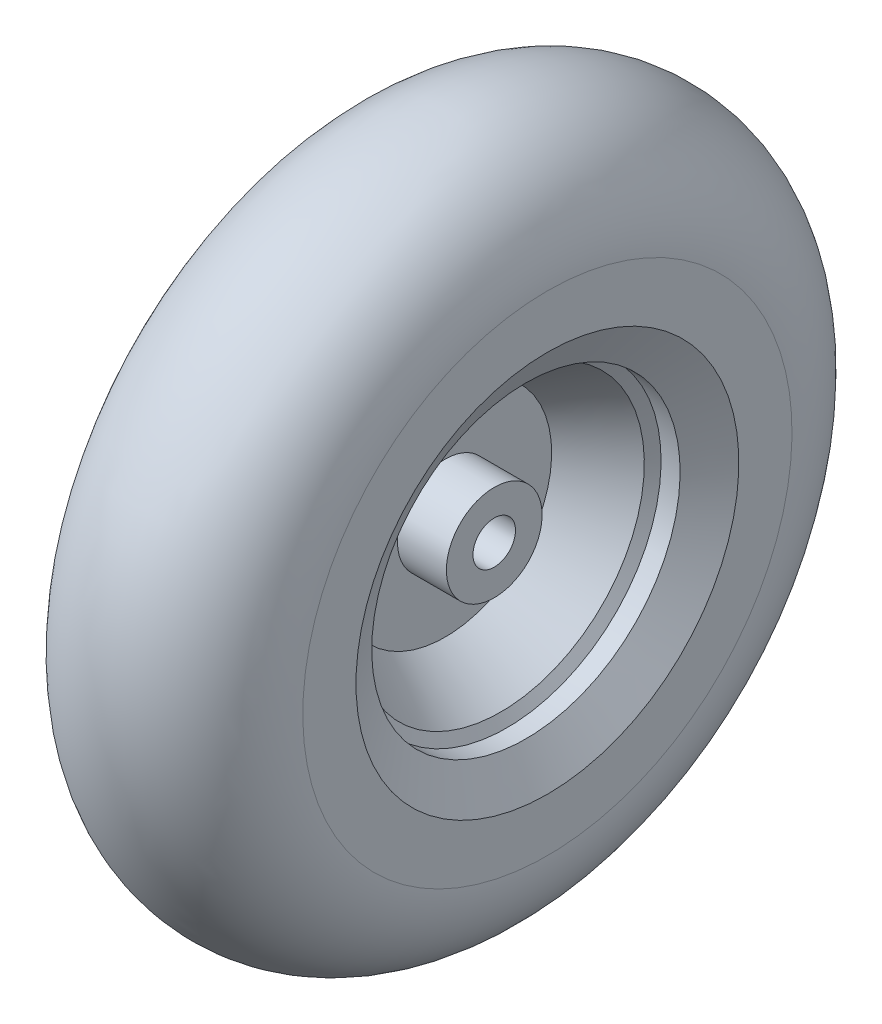
from build123d import *


with BuildPart() as part:
    # Sketch1 → Revolve1 (revolve)
    with BuildSketch(Plane.XY):
        with BuildLine():
            Line((50, 90), (50, 115))
            ThreePointArc((50, 115), (0, 165), (-50, 115))
            Line((-50, 115), (-50, 90))
            Line((-50, 90), (-39.896370289, 72.5))
            Line((-39.896370289, 72.5), (-30.95, 72.5))
            Line((-30.95, 72.5), (-28.063248654, 67.5))
            Line((-28.063248654, 67.5), (-2, 50))
            Line((-2, 50), (-2, 22.5))
            Line((-2, 22.5), (-40, 22.5))
            Line((-40, 22.5), (-40, 10))
            Line((-40, 10), (0, 10))
            Line((0, 10), (25, 10))
            Line((25, 10), (25, 22.5))
            Line((25, 22.5), (2, 22.5))
            Line((2, 22.5), (2, 50))
            Line((2, 50), (28.063248654, 67.5))
            Line((28.063248654, 67.5), (30.95, 72.5))
            Line((30.95, 72.5), (39.896370289, 72.5))
            Line((39.896370289, 72.5), (50, 90))
        make_face()
    revolve(axis=Axis((0, 0, 0), (-1, 0, 0)))


solid = part.part
